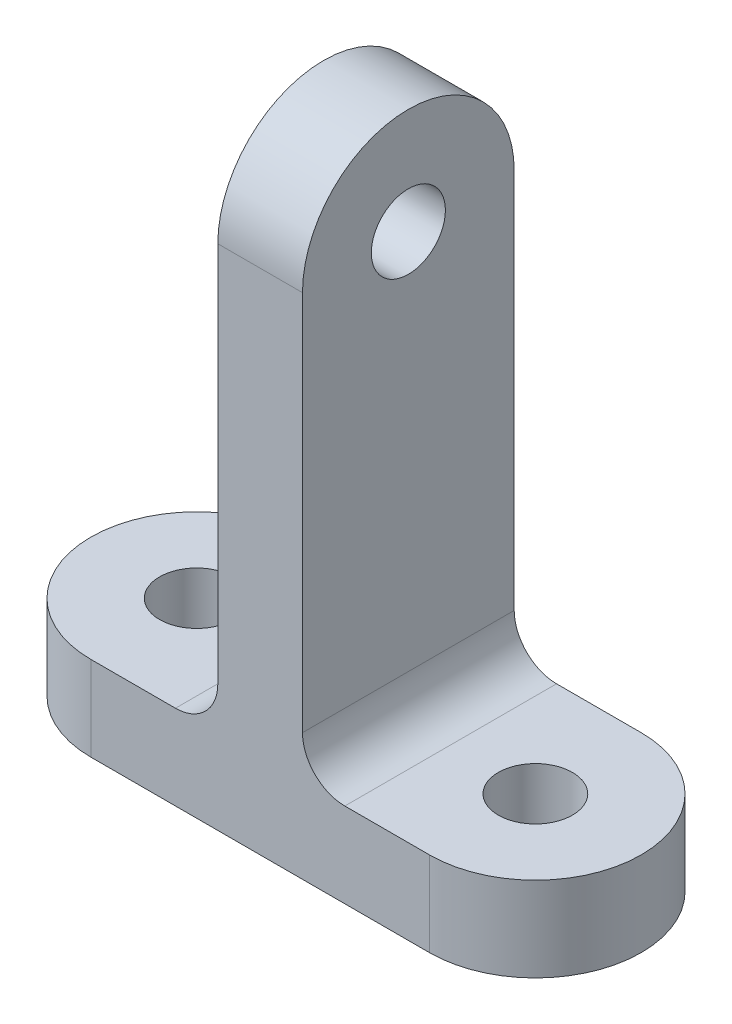
from build123d import *

# Parameters (mm, degrees)
SKETCH1_R           = 5
SKETCH1_R_2         = 1.75
BOSS_EXTRUDE1_DEPTH = 4
SKETCH2_W           = 4
SKETCH2_H           = 10
BOSS_EXTRUDE2_DEPTH = 25
SKETCH3_R           = 1.75
CUT_EXTRUDE1_DEPTH  = 4
FILLET1_R           = 2
FILLET2_R           = 2


with BuildPart() as part:
    # Sketch1 → Boss-Extrude1 (new body)
    # profile 1 of 3: a face of its own
    with BuildSketch(Plane(origin=(0, 0, 0), x_dir=(1, 0, 0), z_dir=(0, 1, 0))):
        with Locations((-8, 0)):
            Circle(SKETCH1_R)
        with Locations(Location((-8, 0, 0), (0, 0, 270))):
            Circle(SKETCH1_R_2, mode=Mode.SUBTRACT)
    # profile 2 of 3: a face of its own
    with BuildSketch(Plane(origin=(0, 0, 0), x_dir=(1, 0, 0), z_dir=(0, 1, 0))):
        with BuildLine():
            Line((8, 5), (-8, 5))
            ThreePointArc((-8, 5), (-4.464466094, 3.535533906), (-3, 0))
            ThreePointArc((-3, 0), (-4.464466094, -3.535533906), (-8, -5))
            Line((-8, -5), (8, -5))
            ThreePointArc((8, -5), (3, 0), (8, 5))
        make_face()
    # profile 3 of 3: a face of its own
    with BuildSketch(Plane(origin=(0, 0, 0), x_dir=(1, 0, 0), z_dir=(0, 1, 0))):
        with Locations((8, 0)):
            Circle(SKETCH1_R)
        with Locations(Location((8, 0, 0), (0, 0, 270))):
            Circle(SKETCH1_R_2, mode=Mode.SUBTRACT)
    extrude(amount=BOSS_EXTRUDE1_DEPTH)

    # Sketch2 → Boss-Extrude2 (add)
    with BuildSketch(Plane(origin=(0, 4, 0), x_dir=(1, 0, 0), z_dir=(0, 1, 0))):
        Rectangle(SKETCH2_W, SKETCH2_H)
    extrude(amount=BOSS_EXTRUDE2_DEPTH)

    # Sketch3 → Cut-Extrude1 (cut)
    with BuildSketch(Plane(origin=(2, 0, 0), x_dir=(0, 0, -1), z_dir=(1, 0, 0))):
        with BuildLine():
            Line((-5, 29), (-5, 24))
            ThreePointArc((-5, 24), (-3.535533915, 27.535533897), (-2.5e-08, 29))
            Line((-2.5e-08, 29), (-5, 29))
        make_face()
        with BuildLine():
            ThreePointArc((-2.5e-08, 29), (3.535533897, 27.535533915), (5, 24))
            Line((5, 24), (5, 29))
            Line((5, 29), (-2.5e-08, 29))
        make_face()
        with Locations((0, 24)):
            Circle(SKETCH3_R)
    extrude(amount=-CUT_EXTRUDE1_DEPTH, mode=Mode.SUBTRACT)

    # Fillet1
    fillet1_edges = [part.edges().sort_by_distance(p)[0] for p in [
        (2, 4, 0),
    ]]
    fillet(fillet1_edges, radius=FILLET1_R)

    # Fillet2
    fillet2_edges = [part.edges().sort_by_distance(p)[0] for p in [
        (-2, 4, 0),
    ]]
    fillet(fillet2_edges, radius=FILLET2_R)


solid = part.part
